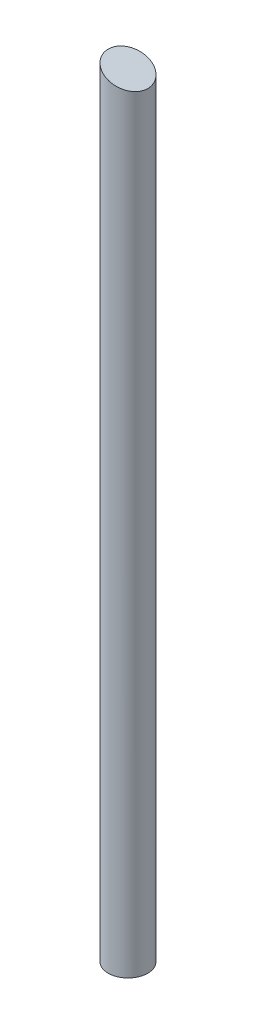
from build123d import *

# Parameters (mm, degrees)
SKETCH_1_R          = 3.5
EXTRUDE_1_DEPTH     = 138
CUT_EXTRUDE_1_DEPTH = 5


with BuildPart() as part:
    # 草圖1 → 填料-伸長1 (new body)
    with BuildSketch(Plane(origin=(0, 0, 0), x_dir=(1, 0, 0), z_dir=(0, 1, 0))):
        with Locations(Location((0, 0, 0), (0, 0, 270))):
            Circle(SKETCH_1_R)
    extrude(amount=EXTRUDE_1_DEPTH)

    # 草圖2 → 除料-伸長1 (cut, symmetric)
    with BuildSketch(Plane.XY):
        Polygon((-3.5, 138), (3.5, 135.45220836), (3.5, 138), align=None)
    extrude(amount=CUT_EXTRUDE_1_DEPTH, both=True, mode=Mode.SUBTRACT)


solid = part.part
